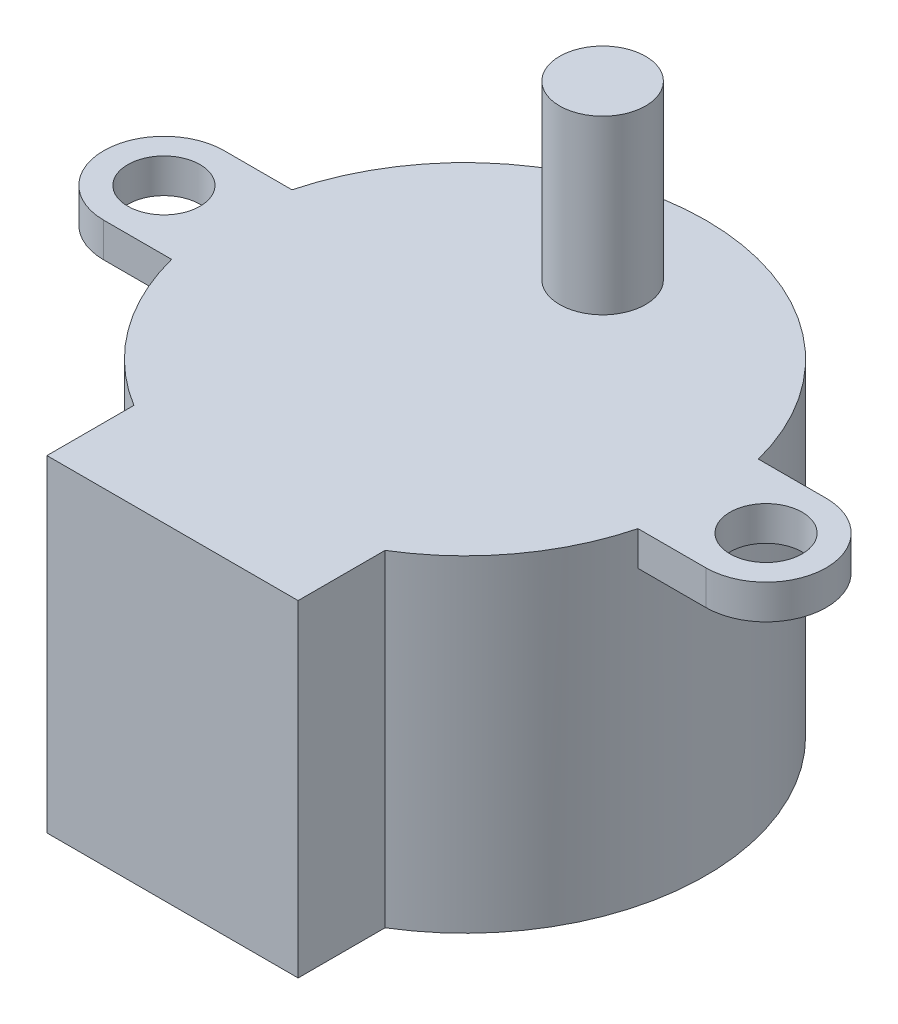
from build123d import *

# Parameters (mm, degrees)
SKETCH1_R           = 14
BOSS_EXTRUDE1_DEPTH = 19
SKETCH2_W           = 14.6
SKETCH2_H           = 5.495823158
BOSS_EXTRUDE2_DEPTH = 19
SKETCH3_R           = 2.1
BOSS_EXTRUDE3_DEPTH = 2
SKETCH4_R           = 2.5
BOSS_EXTRUDE4_DEPTH = 10


with BuildPart() as part:
    # Sketch1 → Boss-Extrude1 (new body)
    with BuildSketch(Plane(origin=(0, 0, 0), x_dir=(1, 0, 0), z_dir=(0, 1, 0))):
        with Locations(Location((0, 0, 0), (0, 0, 270))):
            Circle(SKETCH1_R)
    extrude(amount=BOSS_EXTRUDE1_DEPTH)

    # Sketch2 → Boss-Extrude2 (add)
    with BuildSketch(Plane(origin=(0, 19, 0), x_dir=(1, 0, 0), z_dir=(0, 1, 0))):
        with Locations((0, -14.252088421)):
            Rectangle(SKETCH2_W, SKETCH2_H)
    extrude(amount=-BOSS_EXTRUDE2_DEPTH)

    # Sketch3 → Boss-Extrude3 (add)
    # profile 1 of 2: a face of its own
    with BuildSketch(Plane(origin=(0, 19, 0), x_dir=(1, 0, 0), z_dir=(0, 1, 0))):
        with BuildLine():
            Line((-17.5, 3.5), (-12.399863738, 3.5))
            Line((-12.399863738, 3.5), (-12.399863738, -3.5))
            Line((-12.399863738, -3.5), (-17.5, -3.5))
            ThreePointArc((-17.5, -3.5), (-21, 0), (-17.5, 3.5))
        make_face()
        with Locations(Location((-17.5, 0, 0), (0, 0, 270))):
            Circle(SKETCH3_R, mode=Mode.SUBTRACT)
    # profile 2 of 2: a face of its own
    with BuildSketch(Plane(origin=(0, 19, 0), x_dir=(1, 0, 0), z_dir=(0, 1, 0))):
        with BuildLine():
            Line((12.399863738, -3.5), (17.5, -3.5))
            ThreePointArc((17.5, -3.5), (21, 0), (17.5, 3.5))
            Line((17.5, 3.5), (12.399863738, 3.5))
            Line((12.399863738, 3.5), (12.399863738, -3.5))
        make_face()
        with Locations(Location((17.5, 0, 0), (0, 0, 90))):
            Circle(SKETCH3_R, mode=Mode.SUBTRACT)
    extrude(amount=-BOSS_EXTRUDE3_DEPTH)

    # Sketch4 → Boss-Extrude4 (add)
    with BuildSketch(Plane(origin=(0, 19, 0), x_dir=(1, 0, 0), z_dir=(0, 1, 0))):
        with Locations(Location((0, 8, 0), (0, 0, 270))):
            Circle(SKETCH4_R)
    extrude(amount=BOSS_EXTRUDE4_DEPTH)


solid = part.part
